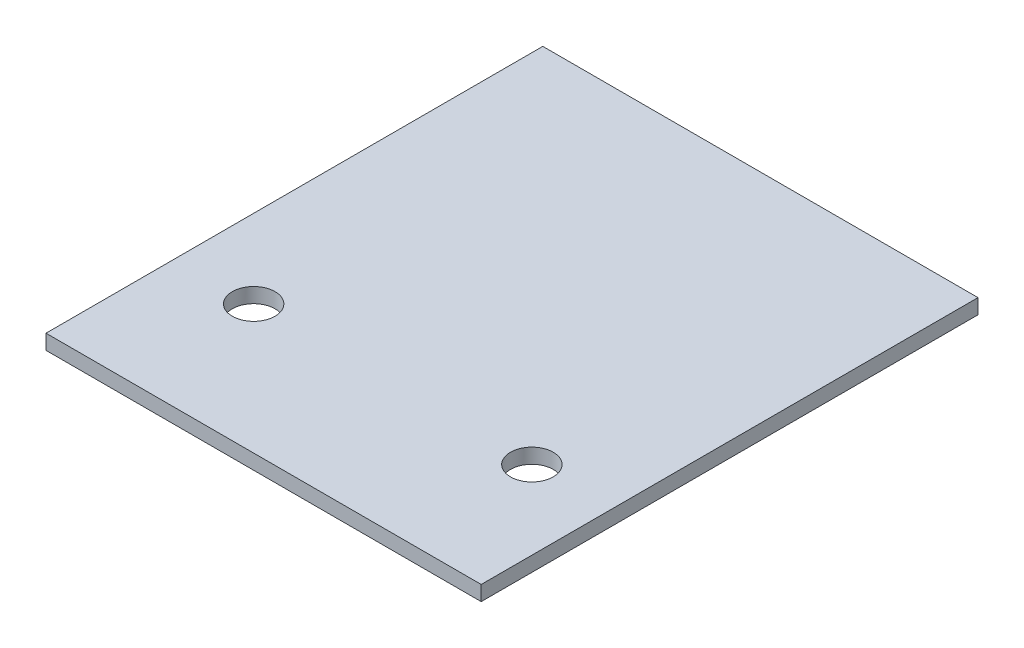
from build123d import *

# Parameters (mm, degrees)
SKETCH_1_W             = 43.8
SKETCH_1_H             = 50
EXTRUDE_1_DEPTH        = 1.5
HOLE_WIZARD_M4_1_D     = 4.3
HOLE_WIZARD_M4_1_DEPTH = 2
HOLE_WIZARD_M4_1_TIP   = 1.291850331


with BuildPart() as part:
    # 草图1 → 凸台-拉伸1 (new body)
    with BuildSketch(Plane(origin=(0, 0, 0), x_dir=(1, 0, 0), z_dir=(0, 1, 0))):
        Rectangle(SKETCH_1_W, SKETCH_1_H)
    extrude(amount=EXTRUDE_1_DEPTH)

    # M4 间隙孔1
    with Locations(Plane(origin=(0, 1.5, 0), x_dir=(1, 0, 0), z_dir=(0, 1, 0))):
        with Locations((-14, -12), (14, -12)):
            Hole(HOLE_WIZARD_M4_1_D / 2, depth=HOLE_WIZARD_M4_1_DEPTH)
            with Locations((0, 0, -(HOLE_WIZARD_M4_1_DEPTH + HOLE_WIZARD_M4_1_TIP / 2))):  # 118° drill point
                Cone(0, HOLE_WIZARD_M4_1_D / 2, HOLE_WIZARD_M4_1_TIP, mode=Mode.SUBTRACT)


solid = part.part
